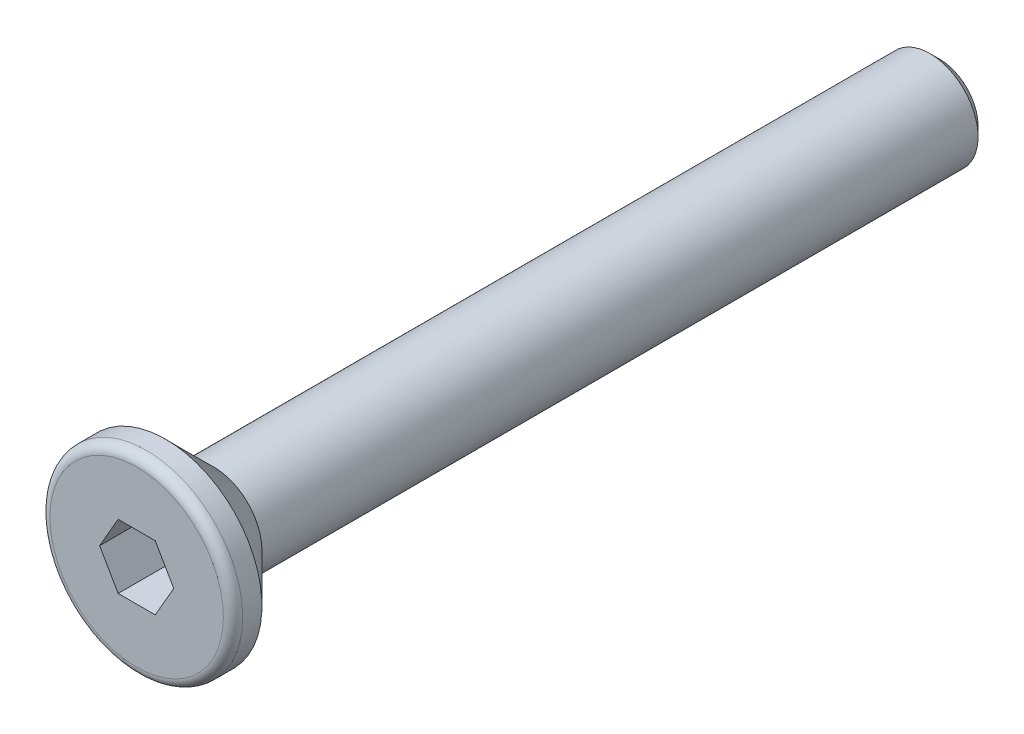
from build123d import *

# Parameters (mm, degrees)
CUT_EXTRUDE_1_DEPTH = 1.5
FILLET_1_R          = 0.3


with BuildPart() as part:
    # 草图1 → 旋转1 (revolve)
    with BuildSketch(Plane(origin=(0, 0, 0), x_dir=(0, 0, -1), z_dir=(1, 0, 0)), mode=Mode.PRIVATE) as revolve_1_sk:
        Polygon((-12.5, 0), (-12.5, 3), (-11.6, 3), (-10.1, 1.5), (12.2, 1.5), (12.5, 1.2), (12.5, 0), align=None)
    revolve(revolve_1_sk.sketch.rotate(Axis((0, 0, -12.5), (0, 0, 1)), 90), axis=Axis((0, 0, -12.5), (0, 0, 1)))

    # 草图2 → 切除-拉伸1 (cut)
    with BuildSketch(Plane.XY.offset(12.5)):
        Polygon((1.154700538, 0), (0.577350269, 1), (-0.577350269, 1), (-1.154700538, 0), (-0.577350269, -1), (0.577350269, -1), align=None)
    extrude(amount=-CUT_EXTRUDE_1_DEPTH, mode=Mode.SUBTRACT)

    # 圆角1
    fillet_1_edges = [part.edges().sort_by_distance(p)[0] for p in [
        (3, 0, 12.5),
    ]]
    fillet(fillet_1_edges, radius=FILLET_1_R)


solid = part.part
